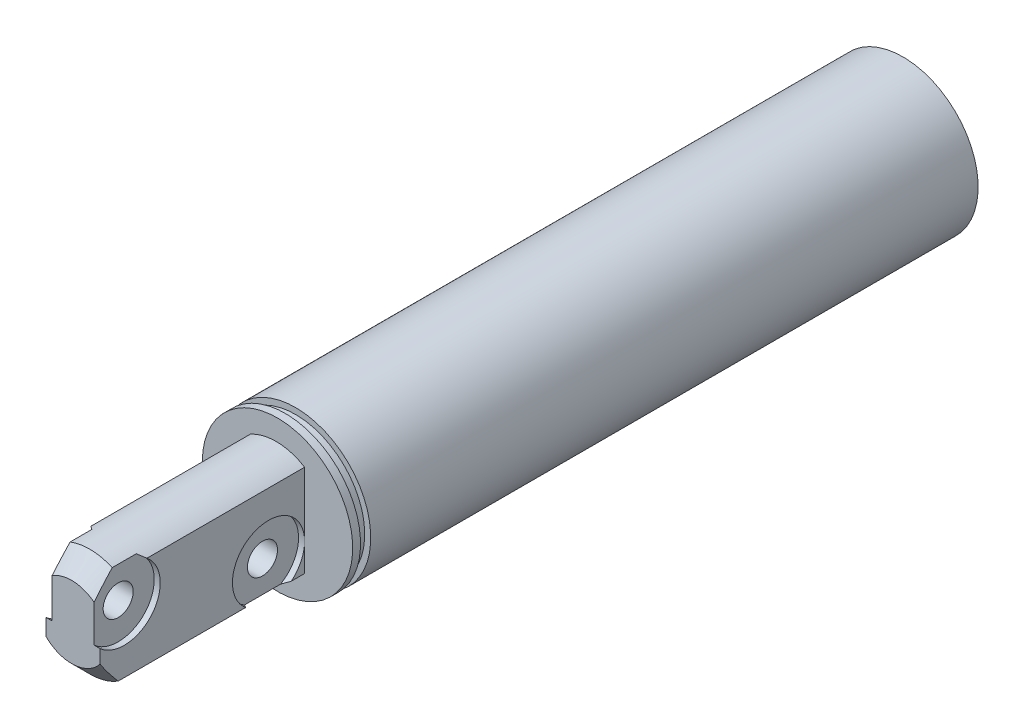
from build123d import *

# Parameters (mm, degrees)
SKETCH_1_R               = 12.5
EXTRUDE_1_DEPTH          = 104
SKETCH_6_W               = 1
SKETCH_6_H               = 1.7
SKETCH_7_R               = 8
EXTRUDE_2_DEPTH          = 2
HOLE_WIZARD_M8_1_D       = 6.8
HOLE_WIZARD_M8_1_DEPTH   = 82.25
HOLE_WIZARD_M8_1_TIP     = 2.042926105
SKETCH_9_R               = 9
EXTRUDE_3_DEPTH          = 34
CUT_EXTRUDE_1_DEPTH      = 140.127639238
CUT_EXTRUDE_1_DEPTH_BACK = 140.127639238
SKETCH_8_W               = 34
SKETCH_8_H               = 10.443945465
CHAMFER_1_SIZE           = 3
HOLE_WIZARD_5_0_5_1_D    = 5
SKETCH_13_R              = 6
CUT_EXTRUDE_3_DEPTH      = 1


with BuildPart() as part:
    # 草图1 → 凸台-拉伸1 (new body)
    with BuildSketch(Plane.XY):
        with Locations(Location((0, 0, 0), (0, 0, 180))):
            Circle(SKETCH_1_R)
    extrude(amount=EXTRUDE_1_DEPTH)

    # 草图6 → 切除-旋转1 (revolve, cut)
    with BuildSketch(Plane(origin=(0, 0, 0), x_dir=(1, 0, 0), z_dir=(0, 1, 0))):
        with Locations((-12, -101.85)):
            Rectangle(SKETCH_6_W, SKETCH_6_H)
    revolve(axis=Axis((0, 0, 0), (0, 0, 1)), mode=Mode.SUBTRACT)

    # 草图7 → 凸台-拉伸2 (add)
    with BuildSketch(Plane(origin=(0, 0, 0), x_dir=(-1, 0, 0), z_dir=(0, 0, -1))):
        with Locations(Location((0, 0, 0), (0, 0, 180))):
            Circle(SKETCH_7_R)
    extrude(amount=EXTRUDE_2_DEPTH)

    # M8 螺纹孔1
    with Locations(Plane(origin=(0, 0, -2), x_dir=(-1, 0, 0), z_dir=(0, 0, -1))):
        with Locations((0, 0)):
            Hole(HOLE_WIZARD_M8_1_D / 2, depth=HOLE_WIZARD_M8_1_DEPTH)
            with Locations((0, 0, -(HOLE_WIZARD_M8_1_DEPTH + HOLE_WIZARD_M8_1_TIP / 2))):  # 118° drill point
                Cone(0, HOLE_WIZARD_M8_1_D / 2, HOLE_WIZARD_M8_1_TIP, mode=Mode.SUBTRACT)

    # 草图9 → 凸台-拉伸3 (add)
    with BuildSketch(Plane.XY.offset(104)):
        with Locations((-0.231058247, 0)):
            Circle(SKETCH_9_R)
    extrude(amount=EXTRUDE_3_DEPTH)

    # 草图8 → 切除-拉伸1 (cut, two sides: drawn at the far end of the back side and taken through both)
    with BuildSketch(Plane(origin=(0, 0, 0), x_dir=(0, 0, -1), z_dir=(0, 1, 0)).offset(-CUT_EXTRUDE_1_DEPTH_BACK)):
        with Locations((-121, 9.721972732)):
            Rectangle(SKETCH_8_W, SKETCH_8_H)
        with Locations((-121, -9.721972732)):
            Rectangle(SKETCH_8_W, SKETCH_8_H)
    extrude(amount=CUT_EXTRUDE_1_DEPTH + CUT_EXTRUDE_1_DEPTH_BACK, mode=Mode.SUBTRACT)

    # 倒角1
    chamfer_1_edges = [part.edges().sort_by_distance(p)[0] for p in [
        (0.035783968, -8.99604331, 138),
        (0.035783968, 8.99604331, 138),
    ]]
    chamfer(chamfer_1_edges, length=CHAMFER_1_SIZE)

    # Ø5.0 (5) 直径孔1 (through all)
    with Locations(Plane(origin=(4.5, 0, 0), x_dir=(0, 0, -1), z_dir=(1, 0, 0))):
        with Locations((-110, -3), (-134, 3)):
            Hole(HOLE_WIZARD_5_0_5_1_D / 2)

    # 草图13 → 切除-拉伸3 (cut)
    with BuildSketch(Plane(origin=(4.5, 0, 0), x_dir=(0, 0, -1), z_dir=(1, 0, 0))):
        with Locations((-134, 3)):
            Circle(SKETCH_13_R)
        with Locations((-110, -3)):
            Circle(SKETCH_13_R)
    cut_extrude_3 = extrude(amount=-CUT_EXTRUDE_3_DEPTH, mode=Mode.SUBTRACT)

    # 镜向1: 切除-拉伸3 across plane
    add(cut_extrude_3.mirror(Plane(origin=(0, 0, 0), x_dir=(0, 0, 1), z_dir=(1, 0, 0))), mode=Mode.SUBTRACT)


solid = part.part
